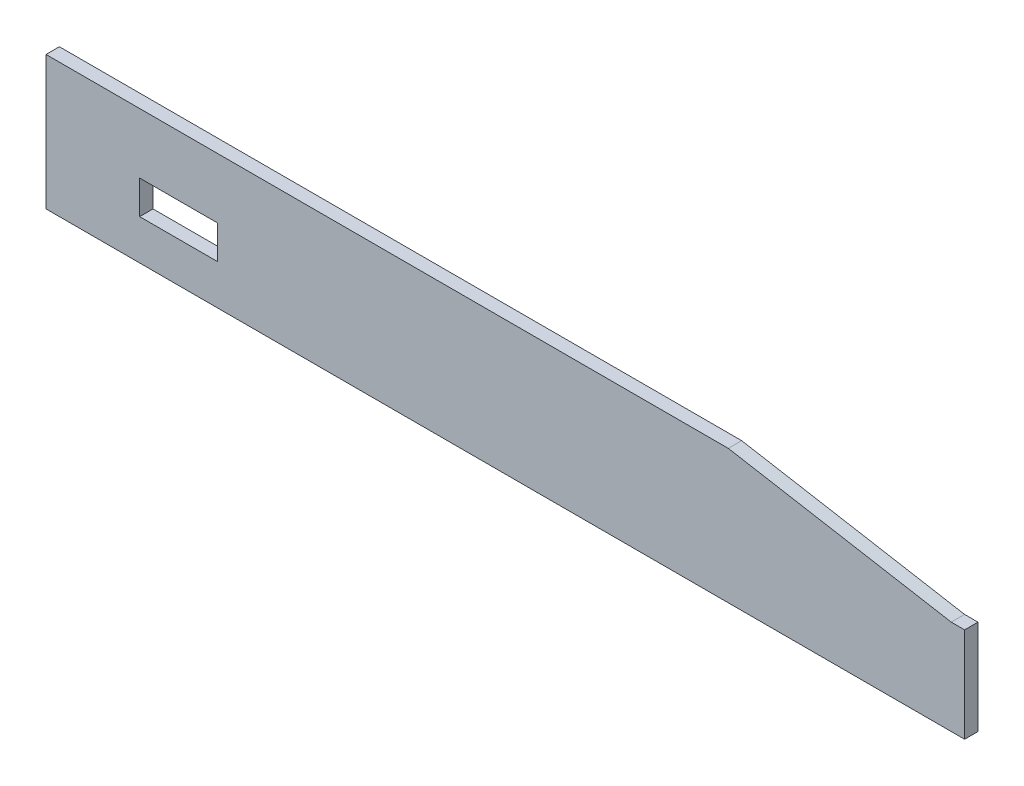
from build123d import *

# Parameters (mm, degrees)
SKETCH1_W           = 35
SKETCH1_H           = 15
BOSS_EXTRUDE1_DEPTH = 6


with BuildPart() as part:
    # Sketch1 → Boss-Extrude1 (new body)
    with BuildSketch(Plane.XY):
        Polygon((-153, 30), (-153, -30), (259, -30), (259, 12.5), (253, 12.5), (153, 30), align=None)
        with Locations((-93.5, -4.5)):
            Rectangle(SKETCH1_W, SKETCH1_H, mode=Mode.SUBTRACT)
    extrude(amount=BOSS_EXTRUDE1_DEPTH)


solid = part.part
